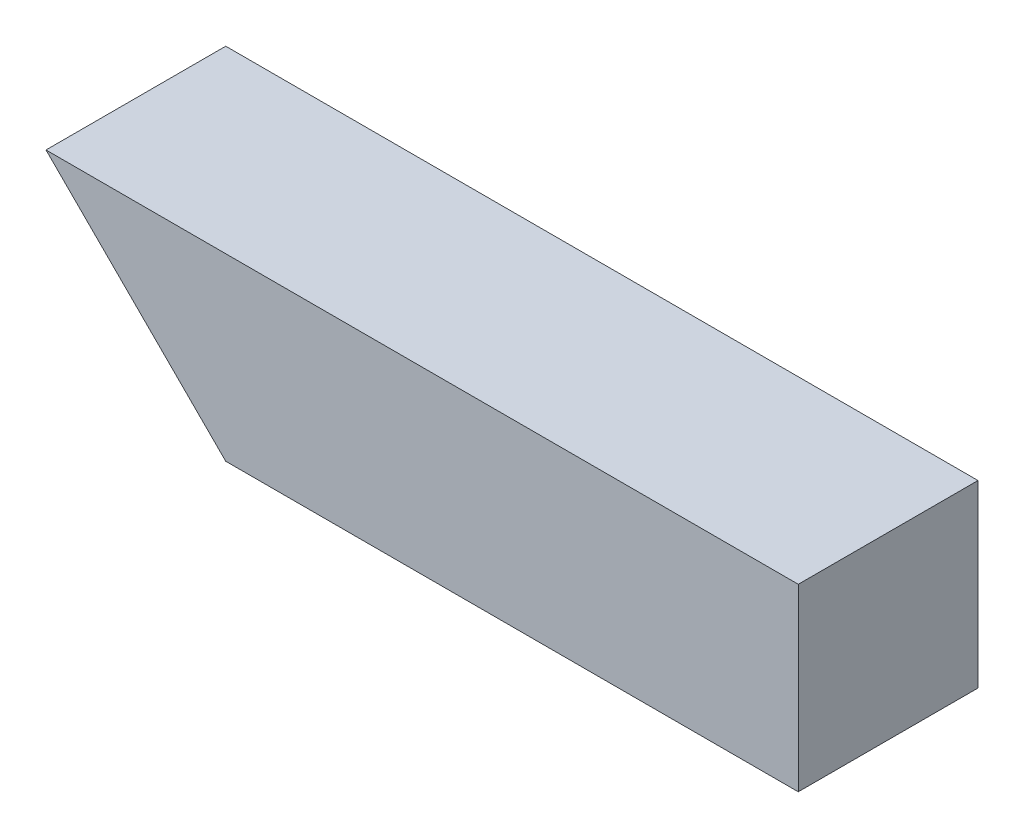
from build123d import *

# Parameters (mm, degrees)
SKETCH1_W               = 38.1
SKETCH1_H               = 38.1
BOSS_EXTRUDE1_DEPTH     = 159.46490586
CUT_EXTRUDE1_DEPTH      = 169.321942126
CUT_EXTRUDE1_DEPTH_BACK = 169.321942126


with BuildPart() as part:
    # Sketch1 → Boss-Extrude1 (new body)
    with BuildSketch(Plane(origin=(0, 0, 0), x_dir=(0, 0, -1), z_dir=(1, 0, 0))):
        with Locations((19.05, -19.05)):
            Rectangle(SKETCH1_W, SKETCH1_H)
    extrude(amount=BOSS_EXTRUDE1_DEPTH)

    # Sketch2 → Cut-Extrude1 (cut, two sides: drawn at the far end of the back side and taken through both)
    with BuildSketch(Plane.XY.offset(-CUT_EXTRUDE1_DEPTH_BACK)):
        Polygon((-337.906487895, -38.1), (0, -38.1), (38.1, -38.1), (0, 0), (-238.935968998, 238.935968998), (-875.356194741, 466.295759882), (-974.326713639, 189.259790884), align=None)
    extrude(amount=CUT_EXTRUDE1_DEPTH + CUT_EXTRUDE1_DEPTH_BACK, mode=Mode.SUBTRACT)


solid = part.part
